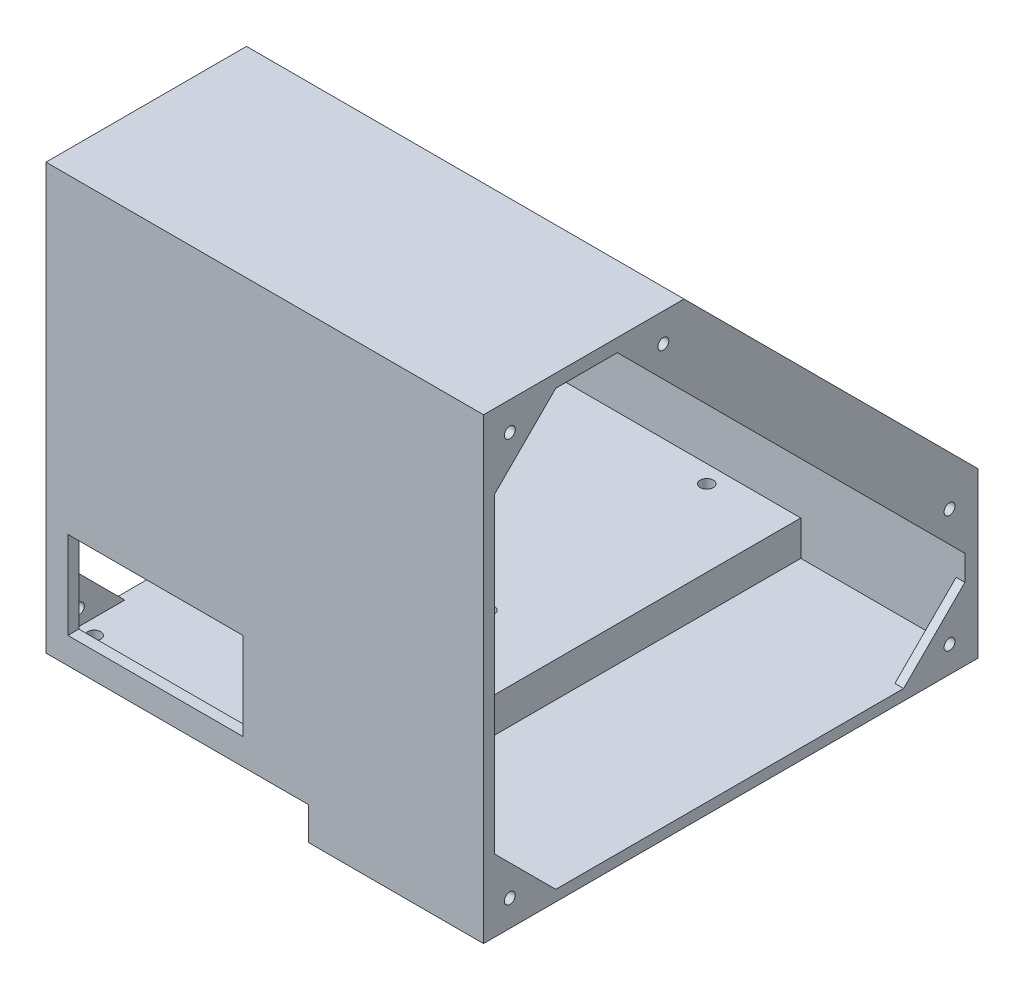
from build123d import *

# Parameters (mm, degrees)
BOSS_EXTRUDE1_DEPTH = 100
SKETCH2_W           = 40
SKETCH2_H           = 3
BOSS_EXTRUDE2_DEPTH = 7.5
SKETCH3_W           = 60
SKETCH3_H           = 110
BOSS_EXTRUDE3_DEPTH = 3
BOSS_EXTRUDE4_DEPTH = 110
BOSS_EXTRUDE5_REACH = 183.953
SKETCH5_W           = 100
SKETCH5_H           = 2.5
CUT_EXTRUDE1_REACH  = 181.477
SKETCH6_R           = 1.5
SKETCH7_R           = 1.25
BOSS_EXTRUDE6_DEPTH = 2
CUT_EXTRUDE2_REACH  = 184.035
SKETCH8_R           = 1.75
SKETCH8_R_2         = 2.5
SKETCH8_W           = 78
SKETCH8_H           = 43.869493833
SKETCH8_W_2         = 27
SKETCH8_H_2         = 12
SKETCH9_W           = 87
SKETCH9_H           = 56
SKETCH9_W_2         = 30
SKETCH9_H_2         = 15
CUT_EXTRUDE3_DEPTH  = 2
SKETCH10_W          = 40
SKETCH10_H          = 20
CUT_EXTRUDE4_DEPTH  = 178.913626945
BOSS_EXTRUDE7_START = -1.5
SKETCH11_R          = 1.25
BOSS_EXTRUDE7_DEPTH = 1.5
CUT_EXTRUDE5_REACH  = 181.477


with BuildPart() as part:
    # Sketch1 → Boss-Extrude1 (new body)
    with BuildSketch(Plane(origin=(0, 0, 0), x_dir=(0, 0, -1), z_dir=(1, 0, 0))):
        Polygon((0, 0), (0, 30), (-67.175144213, 97.175144213), (-113, 97.175144213), (-113, 94.175144213), (-68.4177849, 94.175144213), (-3, 28.757359313), (-3, 0), align=None)
    extrude(amount=BOSS_EXTRUDE1_DEPTH)

    # Sketch2 → Boss-Extrude2 (add)
    with BuildSketch(Plane.XZ):
        with Locations((80, 1.5)):
            Rectangle(SKETCH2_W, SKETCH2_H)
    extrude(amount=BOSS_EXTRUDE2_DEPTH)

    # Sketch3 → Boss-Extrude3 (add)
    with BuildSketch(Plane.XZ):
        with Locations((30, 58)):
            Rectangle(SKETCH3_W, SKETCH3_H)
    extrude(amount=-BOSS_EXTRUDE3_DEPTH)

    # Sketch4 → Boss-Extrude4 (add)
    with BuildSketch(Plane.XY.offset(3)):
        Polygon((60, 3), (60, -7.5), (100, -7.5), (100, -5), (62.5, -5), (62.5, 3), align=None)
    extrude(amount=BOSS_EXTRUDE4_DEPTH)

    # Sketch5 → Boss-Extrude5 (add, up to next)
    with BuildSketch(Plane.XZ.offset(-94.175144213), mode=Mode.PRIVATE) as boss_extrude5_sk1:
        with Locations((50, 111.75)):
            Rectangle(SKETCH5_W, SKETCH5_H)
    boss_extrude5_tool1 = extrude(boss_extrude5_sk1.sketch, amount=BOSS_EXTRUDE5_REACH, mode=Mode.PRIVATE) - part.part
    add(boss_extrude5_tool1.solids().sort_by_distance((50, 94.175144, 111.75))[0])

    # Sketch6 → Cut-Extrude1 (cut, up to next)
    with BuildSketch(Plane.XZ, mode=Mode.PRIVATE) as cut_extrude1_sk1:
        with Locations(Location((5, 107, 0), (0, 0, 270))):
            Circle(SKETCH6_R)
    cut_extrude1_tool1 = extrude(cut_extrude1_sk1.sketch, amount=-CUT_EXTRUDE1_REACH, mode=Mode.PRIVATE) & part.part
    # Sketch6 → Cut-Extrude1 (cut, up to next)
    with BuildSketch(Plane.XZ, mode=Mode.PRIVATE) as cut_extrude1_sk2:
        with Locations(Location((45, 107, 0), (0, 0, 270))):
            Circle(SKETCH6_R)
    cut_extrude1_tool2 = extrude(cut_extrude1_sk2.sketch, amount=-CUT_EXTRUDE1_REACH, mode=Mode.PRIVATE) & part.part
    # Sketch6 → Cut-Extrude1 (cut, up to next)
    with BuildSketch(Plane.XZ, mode=Mode.PRIVATE) as cut_extrude1_sk3:
        with Locations(Location((45, 57, 0), (0, 0, 270))):
            Circle(SKETCH6_R)
    cut_extrude1_tool3 = extrude(cut_extrude1_sk3.sketch, amount=-CUT_EXTRUDE1_REACH, mode=Mode.PRIVATE) & part.part
    # Sketch6 → Cut-Extrude1 (cut, up to next)
    with BuildSketch(Plane.XZ, mode=Mode.PRIVATE) as cut_extrude1_sk4:
        with Locations(Location((5, 57, 0), (0, 0, 270))):
            Circle(SKETCH6_R)
    cut_extrude1_tool4 = extrude(cut_extrude1_sk4.sketch, amount=-CUT_EXTRUDE1_REACH, mode=Mode.PRIVATE) & part.part
    # Sketch6 → Cut-Extrude1 (cut, up to next)
    with BuildSketch(Plane.XZ, mode=Mode.PRIVATE) as cut_extrude1_sk5:
        with Locations(Location((5, 7, 0), (0, 0, 270))):
            Circle(SKETCH6_R)
    cut_extrude1_tool5 = extrude(cut_extrude1_sk5.sketch, amount=-CUT_EXTRUDE1_REACH, mode=Mode.PRIVATE) & part.part
    # Sketch6 → Cut-Extrude1 (cut, up to next)
    with BuildSketch(Plane.XZ, mode=Mode.PRIVATE) as cut_extrude1_sk6:
        with Locations(Location((45, 7, 0), (0, 0, 270))):
            Circle(SKETCH6_R)
    cut_extrude1_tool6 = extrude(cut_extrude1_sk6.sketch, amount=-CUT_EXTRUDE1_REACH, mode=Mode.PRIVATE) & part.part
    add(cut_extrude1_tool1.solids().sort_by_distance((5, 0, 107))[0], mode=Mode.SUBTRACT)
    add(cut_extrude1_tool2.solids().sort_by_distance((45, 0, 107))[0], mode=Mode.SUBTRACT)
    add(cut_extrude1_tool3.solids().sort_by_distance((45, 0, 57))[0], mode=Mode.SUBTRACT)
    add(cut_extrude1_tool4.solids().sort_by_distance((5, 0, 57))[0], mode=Mode.SUBTRACT)
    add(cut_extrude1_tool5.solids().sort_by_distance((5, 0, 7))[0], mode=Mode.SUBTRACT)
    add(cut_extrude1_tool6.solids().sort_by_distance((45, 0, 7))[0], mode=Mode.SUBTRACT)

    # Sketch7 → Boss-Extrude6 (add)
    # profile 1 of 4: a face of its own
    with BuildSketch(Plane(origin=(100, 0, 0), x_dir=(0, 0, -1), z_dir=(1, 0, 0))):
        Polygon((-110.5, -5), (-110.5, 9), (-96.5, -5), align=None)
        with Locations((-107, -1.5)):
            Circle(SKETCH7_R, mode=Mode.SUBTRACT)
    # profile 2 of 4: a face of its own
    with BuildSketch(Plane(origin=(100, 0, 0), x_dir=(0, 0, -1), z_dir=(1, 0, 0))):
        Polygon((-110.5, 94.175144213), (-110.5, 80.175144213), (-96.5, 94.175144213), align=None)
        with Locations((-107, 90.675144213)):
            Circle(SKETCH7_R, mode=Mode.SUBTRACT)
    # profile 3 of 4: a face of its own
    with BuildSketch(Plane(origin=(100, 0, 0), x_dir=(0, 0, -1), z_dir=(1, 0, 0))):
        Polygon((-82.4177849, 94.175144213), (-3, 14.757359313), (-3, 28.757359313), (-68.4177849, 94.175144213), align=None)
        with Locations((-6.5, 25.257359313)):
            Circle(SKETCH7_R, mode=Mode.SUBTRACT)
        with Locations((-71.9177849, 90.675144213)):
            Circle(SKETCH7_R, mode=Mode.SUBTRACT)
    # profile 4 of 4: a face of its own
    with BuildSketch(Plane(origin=(100, 0, 0), x_dir=(0, 0, -1), z_dir=(1, 0, 0))):
        Polygon((-17, -5), (-3, 9), (-3, -5), align=None)
        with Locations((-6.5, -1.5)):
            Circle(SKETCH7_R, mode=Mode.SUBTRACT)
    extrude(amount=-BOSS_EXTRUDE6_DEPTH)

    # Sketch8 → Cut-Extrude2 (cut, up to next)
    with BuildSketch(Plane(origin=(0, 15, -15), x_dir=(1, 0, 0), z_dir=(0, 0.7071067811865488, -0.7071067811865464)), mode=Mode.PRIVATE) as cut_extrude2_sk1:
        with Locations(Location((6.05, -109.488203436, 0), (0, 0, 270))):
            Circle(SKETCH8_R)
    cut_extrude2_tool1 = extrude(cut_extrude2_sk1.sketch, amount=-CUT_EXTRUDE2_REACH, mode=Mode.PRIVATE) & part.part
    # Sketch8 → Cut-Extrude2 (cut, up to next)
    with BuildSketch(Plane(origin=(0, 15, -15), x_dir=(1, 0, 0), z_dir=(0, 0.7071067811865488, -0.7071067811865464)), mode=Mode.PRIVATE) as cut_extrude2_sk2:
        with Locations(Location((93.95, -109.488203436, 0), (0, 0, 270))):
            Circle(SKETCH8_R)
    cut_extrude2_tool2 = extrude(cut_extrude2_sk2.sketch, amount=-CUT_EXTRUDE2_REACH, mode=Mode.PRIVATE) & part.part
    # Sketch8 → Cut-Extrude2 (cut, up to next)
    with BuildSketch(Plane(origin=(0, 15, -15), x_dir=(1, 0, 0), z_dir=(0, 0.7071067811865488, -0.7071067811865464)), mode=Mode.PRIVATE) as cut_extrude2_sk3:
        with Locations(Location((93.95, -44.588203436, 0), (0, 0, 270))):
            Circle(SKETCH8_R)
    cut_extrude2_tool3 = extrude(cut_extrude2_sk3.sketch, amount=-CUT_EXTRUDE2_REACH, mode=Mode.PRIVATE) & part.part
    # Sketch8 → Cut-Extrude2 (cut, up to next)
    with BuildSketch(Plane(origin=(0, 15, -15), x_dir=(1, 0, 0), z_dir=(0, 0.7071067811865488, -0.7071067811865464)), mode=Mode.PRIVATE) as cut_extrude2_sk4:
        with Locations(Location((6.05, -44.588203436, 0), (0, 0, 270))):
            Circle(SKETCH8_R)
    cut_extrude2_tool4 = extrude(cut_extrude2_sk4.sketch, amount=-CUT_EXTRUDE2_REACH, mode=Mode.PRIVATE) & part.part
    # Sketch8 → Cut-Extrude2 (cut, up to next)
    with BuildSketch(Plane(origin=(0, 15, -15), x_dir=(1, 0, 0), z_dir=(0, 0.7071067811865488, -0.7071067811865464)), mode=Mode.PRIVATE) as cut_extrude2_sk5:
        with Locations(Location((51.495, -33.713203436, 0), (0, 0, 270))):
            Circle(SKETCH8_R_2)
    cut_extrude2_tool5 = extrude(cut_extrude2_sk5.sketch, amount=-CUT_EXTRUDE2_REACH, mode=Mode.PRIVATE) & part.part
    # Sketch8 → Cut-Extrude2 (cut, up to next)
    with BuildSketch(Plane(origin=(0, 15, -15), x_dir=(1, 0, 0), z_dir=(0, 0.7071067811865488, -0.7071067811865464)), mode=Mode.PRIVATE) as cut_extrude2_sk6:
        with Locations((50.025, -80.778456519)):
            Rectangle(SKETCH8_W, SKETCH8_H)
    cut_extrude2_tool6 = extrude(cut_extrude2_sk6.sketch, amount=-CUT_EXTRUDE2_REACH, mode=Mode.PRIVATE) & part.part
    # Sketch8 → Cut-Extrude2 (cut, up to next)
    with BuildSketch(Plane(origin=(0, 15, -15), x_dir=(1, 0, 0), z_dir=(0, 0.7071067811865488, -0.7071067811865464)), mode=Mode.PRIVATE) as cut_extrude2_sk7:
        with Locations((19.675, -34.213203436)):
            Rectangle(SKETCH8_W_2, SKETCH8_H_2)
    cut_extrude2_tool7 = extrude(cut_extrude2_sk7.sketch, amount=-CUT_EXTRUDE2_REACH, mode=Mode.PRIVATE) & part.part
    add(cut_extrude2_tool1.solids().sort_by_distance((6.05, 92.419851, 62.419851))[0], mode=Mode.SUBTRACT)
    add(cut_extrude2_tool2.solids().sort_by_distance((93.95, 92.419851, 62.419851))[0], mode=Mode.SUBTRACT)
    add(cut_extrude2_tool3.solids().sort_by_distance((93.95, 46.528621, 16.528621))[0], mode=Mode.SUBTRACT)
    add(cut_extrude2_tool4.solids().sort_by_distance((6.05, 46.528621, 16.528621))[0], mode=Mode.SUBTRACT)
    add(cut_extrude2_tool5.solids().sort_by_distance((51.495, 38.838835, 8.838835))[0], mode=Mode.SUBTRACT)
    add(cut_extrude2_tool6.solids().sort_by_distance((50.025, 72.118994, 42.118994))[0], mode=Mode.SUBTRACT)
    add(cut_extrude2_tool7.solids().sort_by_distance((19.675, 39.192388, 9.192388))[0], mode=Mode.SUBTRACT)

    # Sketch9 → Cut-Extrude3 (cut)
    with BuildSketch(Plane(origin=(0, 12.878679656, -12.878679656), x_dir=(1, 0, 0), z_dir=(0, -0.7071067811865489, 0.7071067811865461))):
        with Locations((48.525, 77.713203436)):
            Rectangle(SKETCH9_W, SKETCH9_H)
        with Locations((19.675, 34.213203436)):
            Rectangle(SKETCH9_W_2, SKETCH9_H_2)
    extrude(amount=-CUT_EXTRUDE3_DEPTH, mode=Mode.SUBTRACT)

    # Sketch10 → Cut-Extrude4 (cut, through all)
    with BuildSketch(Plane(origin=(0, 0, 110.5), x_dir=(-1, 0, 0), z_dir=(0, 0, -1))):
        with Locations((-25, 16)):
            Rectangle(SKETCH10_W, SKETCH10_H)
    extrude(amount=-CUT_EXTRUDE4_DEPTH, mode=Mode.SUBTRACT)

    # Sketch11 → Boss-Extrude7 (add)
    # profile 1 of 3: a face of its own
    with BuildSketch(Plane.ZY.offset(BOSS_EXTRUDE7_START)):
        Polygon((110.5, 94.175144213), (110.5, 80.175144213), (96.5, 94.175144213), align=None)
        with Locations(Location((107, 90.675144213, 0), (0, 0, 180))):
            Circle(SKETCH11_R, mode=Mode.SUBTRACT)
    # profile 2 of 3: a face of its own
    with BuildSketch(Plane.ZY.offset(BOSS_EXTRUDE7_START)):
        Polygon((68.4177849, 94.175144213), (82.4177849, 94.175144213), (4.121320344, 15.878679656), (17, 3), (3, 3), (3, 14.757359313), (3, 28.757359313), align=None)
        with Locations(Location((71.9177849, 90.675144213, 0), (0, 0, 180))):
            Circle(SKETCH11_R, mode=Mode.SUBTRACT)
        with Locations(Location((6.5, 25.257359313, 0), (0, 0, 180))):
            Circle(SKETCH11_R, mode=Mode.SUBTRACT)
        with Locations((6.5, 6.5)):
            Circle(SKETCH11_R, mode=Mode.SUBTRACT)
    # profile 3 of 3: a face of its own
    with BuildSketch(Plane.ZY.offset(BOSS_EXTRUDE7_START)):
        Polygon((96.5, 3), (110.5, 17), (110.5, 3), align=None)
        with Locations((107, 6.5)):
            Circle(SKETCH11_R, mode=Mode.SUBTRACT)
    extrude(amount=BOSS_EXTRUDE7_DEPTH)

    # Sketch12 → Cut-Extrude5 (cut, up to next)
    with BuildSketch(Plane.ZY, mode=Mode.PRIVATE) as cut_extrude5_sk1:
        Polygon((21.213203436, 49.091883092), (55.154328933, 83.033008589), (60.104076401, 78.083261121), (26.162950904, 44.142135624), align=None)
    cut_extrude5_tool1 = extrude(cut_extrude5_sk1.sketch, amount=-CUT_EXTRUDE5_REACH, mode=Mode.PRIVATE) & part.part
    add(cut_extrude5_tool1.solids().sort_by_distance((0, 63.587572, 40.65864))[0], mode=Mode.SUBTRACT)


solid = part.part
